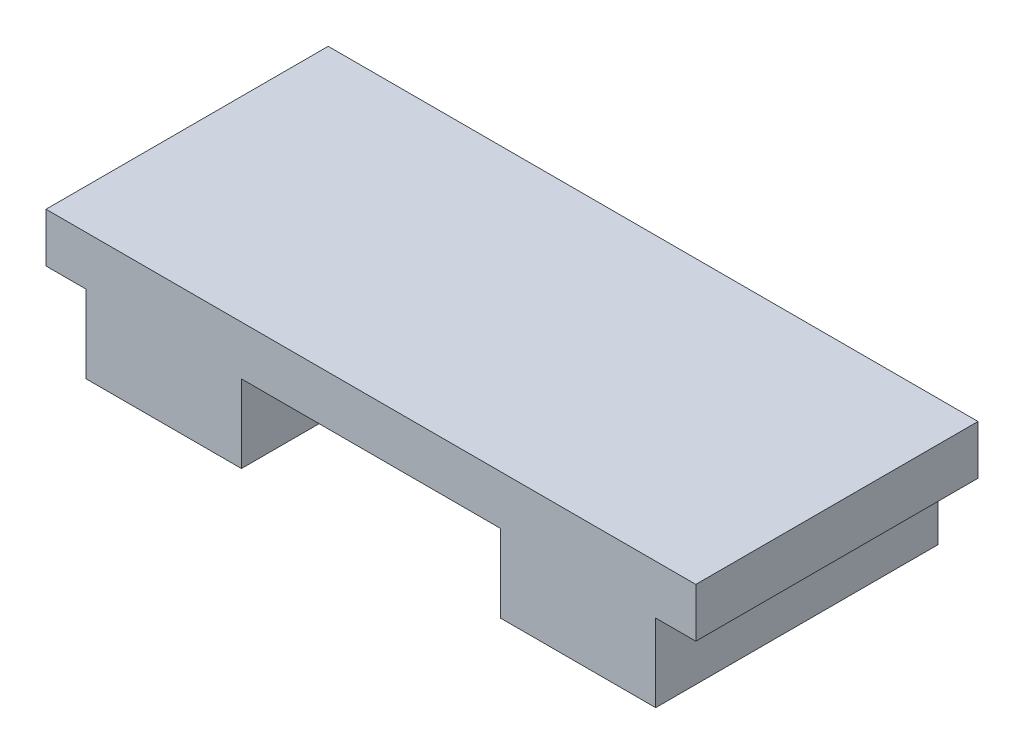
from build123d import *

# Parameters (mm, degrees)
SKETCH1_W             = 6
SKETCH1_H             = 10.9
BOSS_EXTRUDE1_DEPTH   = 3
BOSS_EXTRUDE1_2_DEPTH = 3
SKETCH2_W             = 25.1
SKETCH2_H             = 10.9
BOSS_EXTRUDE2_DEPTH   = 1.9


with BuildPart() as part:
    # Sketch1 → Boss-Extrude1 (new body)
    with BuildSketch(Plane(origin=(0, 0, 0), x_dir=(1, 0, 0), z_dir=(0, 1, 0))):
        with Locations((-8, 0)):
            Rectangle(SKETCH1_W, SKETCH1_H)
    extrude(amount=BOSS_EXTRUDE1_DEPTH)



with BuildPart() as body_2:
    # Sketch1 → Boss-Extrude1 2 (new body)
    with BuildSketch(Plane(origin=(0, 0, 0), x_dir=(1, 0, 0), z_dir=(0, 1, 0))):
        with Locations((8, 0)):
            Rectangle(SKETCH1_W, SKETCH1_H)
    extrude(amount=BOSS_EXTRUDE1_2_DEPTH)


with BuildPart() as part_1:
    add(part.part)

    add(body_2.part)  # Boss-Extrude2 merges body 2
    # Sketch2 → Boss-Extrude2 (add)
    with BuildSketch(Plane(origin=(0, 3, 0), x_dir=(1, 0, 0), z_dir=(0, 1, 0))):
        Rectangle(SKETCH2_W, SKETCH2_H)
    extrude(amount=BOSS_EXTRUDE2_DEPTH)


solid = part_1.part
